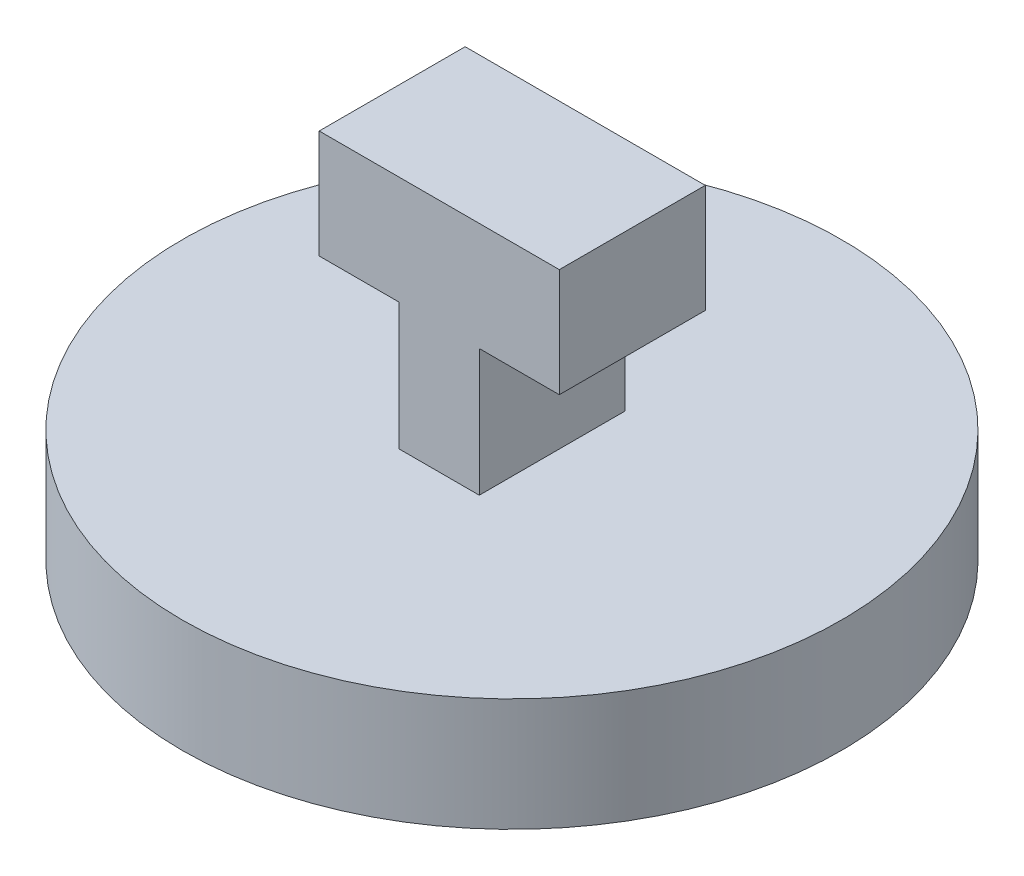
from build123d import *

# Parameters (mm, degrees)
SKETCH1_R                = 7
BOSS_EXTRUDE1_DEPTH      = 2.4
BOSS_EXTRUDE3_DEPTH      = 1.55
BOSS_EXTRUDE3_DEPTH_BACK = 1.55


with BuildPart() as part:
    # Sketch1 → Boss-Extrude1 (new body)
    with BuildSketch(Plane(origin=(0, 0, 0), x_dir=(1, 0, 0), z_dir=(0, 1, 0))):
        Circle(SKETCH1_R)
    extrude(amount=BOSS_EXTRUDE1_DEPTH)

    # Sketch3 → Boss-Extrude3 (add, two sides: drawn at the far end of the back side and taken through both)
    with BuildSketch(Plane.XY.offset(-BOSS_EXTRUDE3_DEPTH_BACK)):
        Polygon((-0.843447487, 2.4), (0, 2.4), (0.856552513, 2.4), (0.856552513, 5.098601719), (2.556552513, 5.098601719), (2.556552513, 7.4), (-2.543447487, 7.4), (-2.543447487, 5.1), (-0.843447487, 5.1), align=None)
    extrude(amount=BOSS_EXTRUDE3_DEPTH + BOSS_EXTRUDE3_DEPTH_BACK)


solid = part.part
